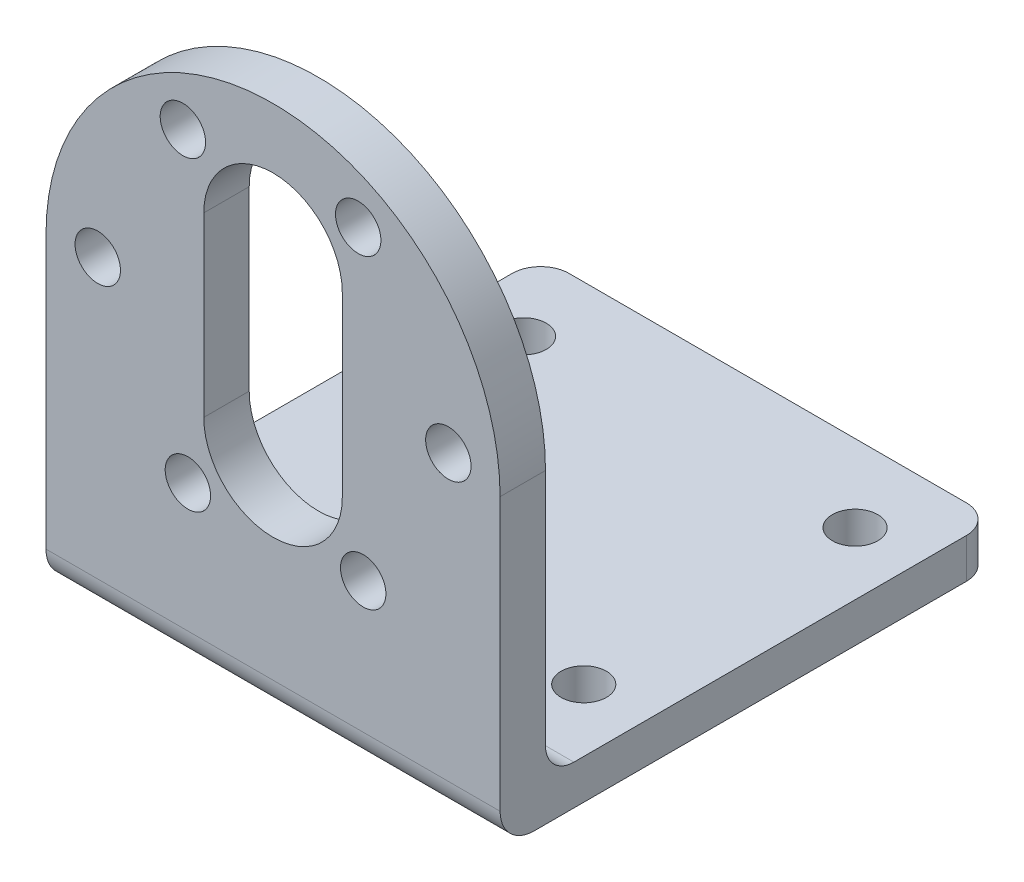
from build123d import *

# Parameters (mm, degrees)
SKETCH2_W           = 1.5
SKETCH2_H           = 37.57
SKETCH2_H_2         = 1.5
SKETCH2_W_2         = 39.569
BOSS_EXTRUDE1_DEPTH = 40
SKETCH3_R           = 1.65
CUT_EXTRUDE1_DEPTH  = 40
SKETCH4_R           = 10.5
SKETCH4_R_2         = 1.65
CUT_EXTRUDE2_DEPTH  = 40
SKETCH_1_R          = 10.5
SKETCH_1_R_2        = 1.65
EXTRUDE_1_DEPTH     = 2.5
FILLET_1_R          = 2.5
SKETCH_2_W          = 40
SKETCH_2_H          = 43.569
SKETCH_2_R          = 1.65
EXTRUDE_2_DEPTH     = 2
FILLET_2_R          = 2.5
SKETCH_3_R          = 1.65
EXTRUDE_3_DEPTH     = 3.5
SKETCH_4_R          = 2
CUT_EXTRUDE_1_DEPTH = 3.5
FILLET_3_R          = 3
SKETCH_5_W          = 40
SKETCH_5_H          = 4
EXTRUDE_4_DEPTH     = 27
FILLET_4_R          = 3
EXTRUDE_5_DEPTH     = 4
CUT_EXTRUDE_2_DEPTH = 4
SKETCH_10_R         = 2
CUT_EXTRUDE_3_DEPTH = 4


with BuildPart() as part:
    # Sketch2 → Boss-Extrude1 (new body)
    with BuildSketch(Plane(origin=(0, 0, 0), x_dir=(0, 0, -1), z_dir=(1, 0, 0))):
        with Locations((-36.139408466, 17.750517241)):
            Rectangle(SKETCH2_W, SKETCH2_H)
        with Locations((-36.139408466, -1.784482759)):
            Rectangle(SKETCH2_W, SKETCH2_H_2)
        with Locations((-15.604908466, -1.784482759)):
            Rectangle(SKETCH2_W_2, SKETCH2_H_2)
    extrude(amount=BOSS_EXTRUDE1_DEPTH)

    # Sketch3 → Cut-Extrude1 (cut)
    with BuildSketch(Plane(origin=(0, -1.034482759, 0), x_dir=(1, 0, 0), z_dir=(0, 1, 0))):
        with Locations(Location((4.5, -30.820408466, 0), (0, 0, 270))):
            Circle(SKETCH3_R)
        with Locations(Location((4.5, -20.820408466, 0), (0, 0, 270))):
            Circle(SKETCH3_R)
        with Locations(Location((4.5, -10.820408466, 0), (0, 0, 270))):
            Circle(SKETCH3_R)
        with Locations(Location((4.5, -0.820408466, 0), (0, 0, 270))):
            Circle(SKETCH3_R)
        with Locations(Location((35.5, -30.820408466, 0), (0, 0, 270))):
            Circle(SKETCH3_R)
        with Locations(Location((35.5, -20.820408466, 0), (0, 0, 270))):
            Circle(SKETCH3_R)
        with Locations(Location((35.5, -10.820408466, 0), (0, 0, 270))):
            Circle(SKETCH3_R)
        with Locations(Location((35.5, -0.820408466, 0), (0, 0, 270))):
            Circle(SKETCH3_R)
    extrude(amount=-CUT_EXTRUDE1_DEPTH, mode=Mode.SUBTRACT)

    # Sketch4 → Cut-Extrude2 (cut)
    with BuildSketch(Plane(origin=(0, 0, 35.389408466), x_dir=(-1, 0, 0), z_dir=(0, 0, -1))):
        with Locations(Location((-20, 16.535517241, 0), (0, 0, 90))):
            Circle(SKETCH4_R)
        with Locations(Location((-11.070998723, 25.983952889, 0), (0, 0, 90))):
            Circle(SKETCH4_R_2)
        with Locations(Location((-10.551564352, 7.606515964, 0), (0, 0, 90))):
            Circle(SKETCH4_R_2)
        with Locations(Location((-29.448435648, 25.464518519, 0), (0, 0, 90))):
            Circle(SKETCH4_R_2)
        with Locations(Location((-28.929001277, 7.087081594, 0), (0, 0, 90))):
            Circle(SKETCH4_R_2)
        with BuildLine():
            Line((-40, 36.535517241), (-40, 16.535517241))
            ThreePointArc((-40, 16.535517241), (-34.142135624, 30.677652865), (-20, 36.535517241))
            Line((-20, 36.535517241), (-40, 36.535517241))
        make_face()
        with BuildLine():
            Line((0, 36.535517241), (-20, 36.535517241))
            ThreePointArc((-20, 36.535517241), (-5.857864785, 30.677653274), (0, 16.535518399))
            Line((0, 16.535518399), (0, 36.535517241))
        make_face()
    extrude(amount=-CUT_EXTRUDE2_DEPTH, mode=Mode.SUBTRACT)

    # 草图1 → 凸台-拉伸1 (add)
    with BuildSketch(Plane.XY.offset(36.889408466)):
        with BuildLine():
            Line((0, 16.535517241), (0, -2.534482759))
            Line((0, -2.534482759), (40, -2.534482759))
            Line((40, -2.534482759), (40, 16.535517241))
            ThreePointArc((40, 16.535517241), (20, 36.535517241), (0, 16.535517241))
        make_face()
        with Locations(Location((20, 16.535517241, 0), (0, 0, 90))):
            Circle(SKETCH_1_R, mode=Mode.SUBTRACT)
        with Locations(Location((11.070998723, 25.983952889, 0), (0, 0, 90))):
            Circle(SKETCH_1_R_2, mode=Mode.SUBTRACT)
        with Locations(Location((29.448435648, 25.464518519, 0), (0, 0, 90))):
            Circle(SKETCH_1_R_2, mode=Mode.SUBTRACT)
        with Locations(Location((28.929001277, 7.087081594, 0), (0, 0, 90))):
            Circle(SKETCH_1_R_2, mode=Mode.SUBTRACT)
        with Locations(Location((10.551564352, 7.606515964, 0), (0, 0, 90))):
            Circle(SKETCH_1_R_2, mode=Mode.SUBTRACT)
    extrude(amount=EXTRUDE_1_DEPTH)

    # 圆角1
    fillet_1_edges = [part.edges().sort_by_distance(p)[0] for p in [
        (20, -1.034482759, 35.389408466),
    ]]
    fillet(fillet_1_edges, radius=FILLET_1_R)

    # 草图2 → 凸台-拉伸2 (add)
    with BuildSketch(Plane.XZ.offset(2.534482759)):
        with Locations((20, 17.604908466)):
            Rectangle(SKETCH_2_W, SKETCH_2_H)
        with Locations(Location((4.5, 30.820408466, 0), (0, 0, 90))):
            Circle(SKETCH_2_R, mode=Mode.SUBTRACT)
        with Locations(Location((4.5, 20.820408466, 0), (0, 0, 90))):
            Circle(SKETCH_2_R, mode=Mode.SUBTRACT)
        with Locations(Location((4.5, 0.820408466, 0), (0, 0, 90))):
            Circle(SKETCH_2_R, mode=Mode.SUBTRACT)
        with Locations(Location((4.5, 10.820408466, 0), (0, 0, 90))):
            Circle(SKETCH_2_R, mode=Mode.SUBTRACT)
        with Locations(Location((35.5, 30.820408466, 0), (0, 0, 90))):
            Circle(SKETCH_2_R, mode=Mode.SUBTRACT)
        with Locations(Location((35.5, 20.820408466, 0), (0, 0, 90))):
            Circle(SKETCH_2_R, mode=Mode.SUBTRACT)
        with Locations(Location((35.5, 10.820408466, 0), (0, 0, 90))):
            Circle(SKETCH_2_R, mode=Mode.SUBTRACT)
        with Locations(Location((35.5, 0.820408466, 0), (0, 0, 90))):
            Circle(SKETCH_2_R, mode=Mode.SUBTRACT)
    extrude(amount=EXTRUDE_2_DEPTH)

    # 圆角2
    fillet_2_edges = [part.edges().sort_by_distance(p)[0] for p in [
        (40, -3.534482759, -4.179591534),
        (0, -3.534482759, -4.179591534),
    ]]
    fillet(fillet_2_edges, radius=FILLET_2_R)

    # 草图3 → 凸台-拉伸3 (add)
    with BuildSketch(Plane(origin=(0, -1.034482759, 0), x_dir=(1, 0, 0), z_dir=(0, 1, 0))):
        with Locations((35.5, -0.820408466)):
            Circle(SKETCH_3_R)
        with Locations((35.5, -10.820408466)):
            Circle(SKETCH_3_R)
        with Locations((35.5, -20.820408466)):
            Circle(SKETCH_3_R)
        with Locations((35.5, -30.820408466)):
            Circle(SKETCH_3_R)
        with Locations((4.5, -0.820408466)):
            Circle(SKETCH_3_R)
        with Locations((4.5, -10.820408466)):
            Circle(SKETCH_3_R)
        with Locations((4.5, -20.820408466)):
            Circle(SKETCH_3_R)
        with Locations((4.5, -30.820408466)):
            Circle(SKETCH_3_R)
    extrude(amount=-EXTRUDE_3_DEPTH)

    # 草图4 → 切除-拉伸1 (cut)
    with BuildSketch(Plane(origin=(0, -1.034482759, 0), x_dir=(1, 0, 0), z_dir=(0, 1, 0))):
        with Locations(Location((34.5, -2.620408466, 0), (0, 0, 270))):
            Circle(SKETCH_4_R)
        with Locations(Location((34.5, -26.520408466, 0), (0, 0, 270))):
            Circle(SKETCH_4_R)
        with Locations(Location((5.3, -2.620408466, 0), (0, 0, 270))):
            Circle(SKETCH_4_R)
        with Locations(Location((5.3, -26.520408466, 0), (0, 0, 270))):
            Circle(SKETCH_4_R)
    extrude(amount=-CUT_EXTRUDE_1_DEPTH, mode=Mode.SUBTRACT)

    # 圆角3
    fillet_3_edges = [part.edges().sort_by_distance(p)[0] for p in [
        (20, -4.534482759, 39.389408466),
    ]]
    fillet(fillet_3_edges, radius=FILLET_3_R)

    # 草图5 → 凸台-拉伸4 (add)
    with BuildSketch(Plane.XZ.offset(4.534482759)):
        with Locations((20, 37.389408466)):
            Rectangle(SKETCH_5_W, SKETCH_5_H)
    extrude(amount=-EXTRUDE_4_DEPTH)

    # 圆角4
    fillet_4_edges = [part.edges().sort_by_distance(p)[0] for p in [
        (20, -4.534482759, 39.389408466),
    ]]
    fillet(fillet_4_edges, radius=FILLET_4_R)

    # 草图7 → 凸台-拉伸5 (add)
    with BuildSketch(Plane.XY.offset(39.389408466)):
        with BuildLine():
            Line((0, 22.465517241), (40, 22.465517241))
            ThreePointArc((40, 22.465517241), (20, 42.465517241), (0, 22.465517241))
        make_face()
    extrude(amount=-EXTRUDE_5_DEPTH)

    # 草图8 → 切除-拉伸2 (cut)
    with BuildSketch(Plane.XY.offset(39.389408466)):
        with BuildLine():
            Line((26.1, 31.065517241), (26.1, 15.465517241))
            ThreePointArc((26.1, 15.465517241), (20, 9.365517241), (13.9, 15.465517241))
            Line((13.9, 15.465517241), (13.9, 31.065517241))
            ThreePointArc((13.9, 31.065517241), (20, 37.165517241), (26.1, 31.065517241))
        make_face()
    extrude(amount=-CUT_EXTRUDE_2_DEPTH, mode=Mode.SUBTRACT)

    # 草图10 → 切除-拉伸3 (cut)
    with BuildSketch(Plane.XY.offset(39.389408466)):
        with Locations((12.5, 9.765517241)):
            Circle(SKETCH_10_R)
        with Locations((27.941342951, 10.020326713)):
            Circle(SKETCH_10_R)
        with Locations((35.441342951, 23.520326713)):
            Circle(SKETCH_10_R)
        with Locations((27.5, 36.765517241)):
            Circle(SKETCH_10_R)
        with Locations((12.058657049, 36.51070777)):
            Circle(SKETCH_10_R)
        with Locations((4.558657049, 23.01070777)):
            Circle(SKETCH_10_R)
    extrude(amount=-CUT_EXTRUDE_3_DEPTH, mode=Mode.SUBTRACT)


solid = part.part
